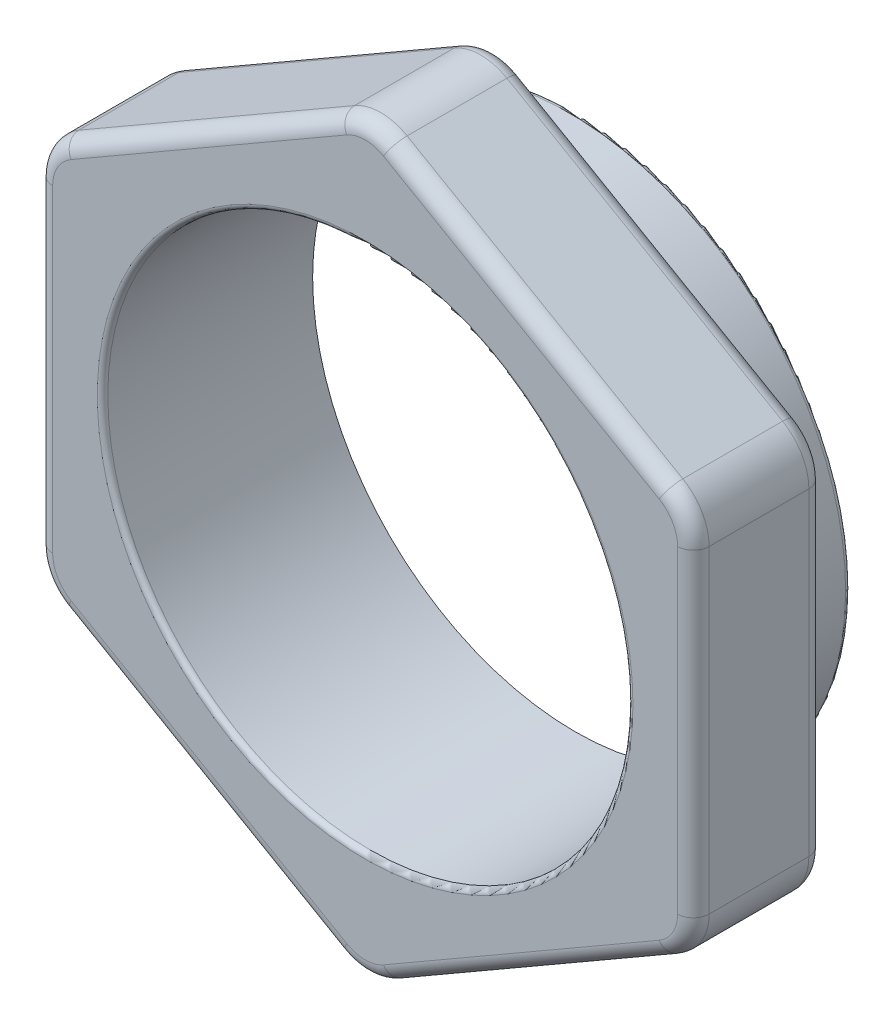
from build123d import *

# Parameters (mm, degrees)
SKETCH1_R           = 6.6675
BOSS_EXTRUDE1_DEPTH = 1.905
BOSS_EXTRUDE2_DEPTH = 3.175
SKETCH3_R           = 6.35
CUT_EXTRUDE1_DEPTH  = 14.145931484
FILLET1_R           = 1.27
FILLET2_R           = 0.381
FILLET3_R           = 0.381
FILLET4_R           = 0.127
FILLET5_R           = 0.127


with BuildPart() as part:
    # Sketch1 → Boss-Extrude1 (new body)
    with BuildSketch(Plane.XY):
        with Locations(Location((0, 0, 0), (0, 0, 180))):
            Circle(SKETCH1_R)
    extrude(amount=BOSS_EXTRUDE1_DEPTH)

    # Sketch2 → Boss-Extrude2 (add)
    with BuildSketch(Plane.XY.offset(1.905)):
        Polygon((0, -9.165435523), (7.9375, -4.582717762), (7.9375, 4.582717762), (0, 9.165435523), (-7.9375, 4.582717762), (-7.9375, -4.582717762), align=None)
    extrude(amount=BOSS_EXTRUDE2_DEPTH)

    # Sketch3 → Cut-Extrude1 (cut, through all)
    with BuildSketch(Plane(origin=(0, 0, 0), x_dir=(-1, 0, 0), z_dir=(0, 0, -1))):
        Circle(SKETCH3_R)
    extrude(amount=-CUT_EXTRUDE1_DEPTH, mode=Mode.SUBTRACT)

    # Fillet1
    fillet1_edges = [part.edges().sort_by_distance(p)[0] for p in [
        (-7.9375, -4.582717762, 3.4925),
        (0, -9.165435523, 3.4925),
        (7.9375, -4.582717762, 3.4925),
        (7.9375, 4.582717762, 3.4925),
        (0, 9.165435523, 3.4925),
        (-7.9375, 4.582717762, 3.4925),
    ]]
    fillet(fillet1_edges, radius=FILLET1_R)

    # Fillet2
    fillet2_edges = [part.edges().sort_by_distance(p)[0] for p in [
        (-7.9375, 0, 1.905),
        (-3.96875, -6.874076643, 1.905),
        (-3.96875, 6.874076643, 1.905),
        (3.96875, 6.874076643, 1.905),
        (7.9375, 0, 1.905),
        (3.96875, -6.874076643, 1.905),
        (0, 8.96896584, 1.905),
        (7.767352263, 4.48448292, 1.905),
        (7.767352263, -4.48448292, 1.905),
        (0, -8.96896584, 1.905),
        (-7.767352263, -4.48448292, 1.905),
        (-7.767352263, 4.48448292, 1.905),
    ]]
    fillet(fillet2_edges, radius=FILLET2_R)

    # Fillet3
    fillet3_edges = [part.edges().sort_by_distance(p)[0] for p in [
        (-7.9375, 0, 5.08),
        (-3.96875, 6.874076643, 5.08),
        (-3.96875, -6.874076643, 5.08),
        (3.96875, -6.874076643, 5.08),
        (7.9375, 0, 5.08),
        (3.96875, 6.874076643, 5.08),
        (0, 8.96896584, 5.08),
        (7.767352263, 4.48448292, 5.08),
        (7.767352263, -4.48448292, 5.08),
        (0, -8.96896584, 5.08),
        (-7.767352263, -4.48448292, 5.08),
        (-7.767352263, 4.48448292, 5.08),
    ]]
    fillet(fillet3_edges, radius=FILLET3_R)

    # Fillet4
    fillet4_edges = [part.edges().sort_by_distance(p)[0] for p in [
        (6.35, 0, 5.08),
    ]]
    fillet(fillet4_edges, radius=FILLET4_R)

    # Fillet5
    fillet5_edges = [part.edges().sort_by_distance(p)[0] for p in [
        (6.6675, 0, 0),
        (6.6675, 0, 1.905),
    ]]
    fillet(fillet5_edges, radius=FILLET5_R)


solid = part.part
